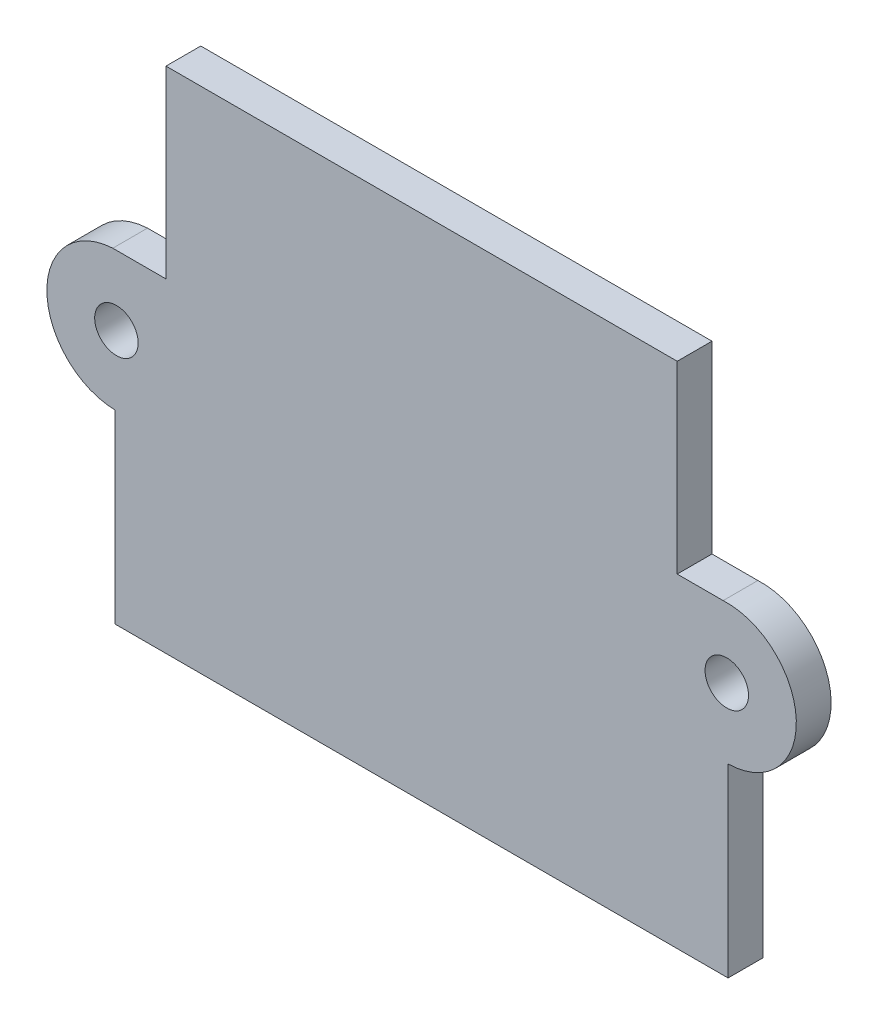
from build123d import *

# Parameters (mm, degrees)
SKETCH1_R           = 0.635000006
BOSS_EXTRUDE1_DEPTH = 1.016


with BuildPart() as part:
    # Sketch1 → Boss-Extrude1 (new body)
    with BuildSketch(Plane.XY):
        with BuildLine():
            Line((-7.4676, 7.430550118), (7.4676, 7.430550118))
            Line((7.4676, 7.430550118), (7.4676, 2.045750118))
            Line((7.4676, 2.045750118), (8.808625011, 2.045750118))
            ThreePointArc((8.808625011, 2.045750118), (10.946108081, 0.089005249), (8.9535, -2.015085385))
            Line((8.9535, -2.015085385), (8.9535, -7.430550118))
            Line((8.9535, -7.430550118), (-8.9535, -7.430550118))
            Line((-8.9535, -7.430550118), (-8.9535, -2.015085385))
            ThreePointArc((-8.9535, -2.015085385), (-10.947109486, -0.017801943), (-9.022174989, 2.045750118))
            Line((-9.022174989, 2.045750118), (-7.4676, 2.045750118))
            Line((-7.4676, 2.045750118), (-7.4676, 7.430550118))
        make_face()
        with Locations((-8.9154, 0.016557396)):
            Circle(SKETCH1_R, mode=Mode.SUBTRACT)
        with Locations((8.9154, 0.016557396)):
            Circle(SKETCH1_R, mode=Mode.SUBTRACT)
    extrude(amount=BOSS_EXTRUDE1_DEPTH)


solid = part.part
